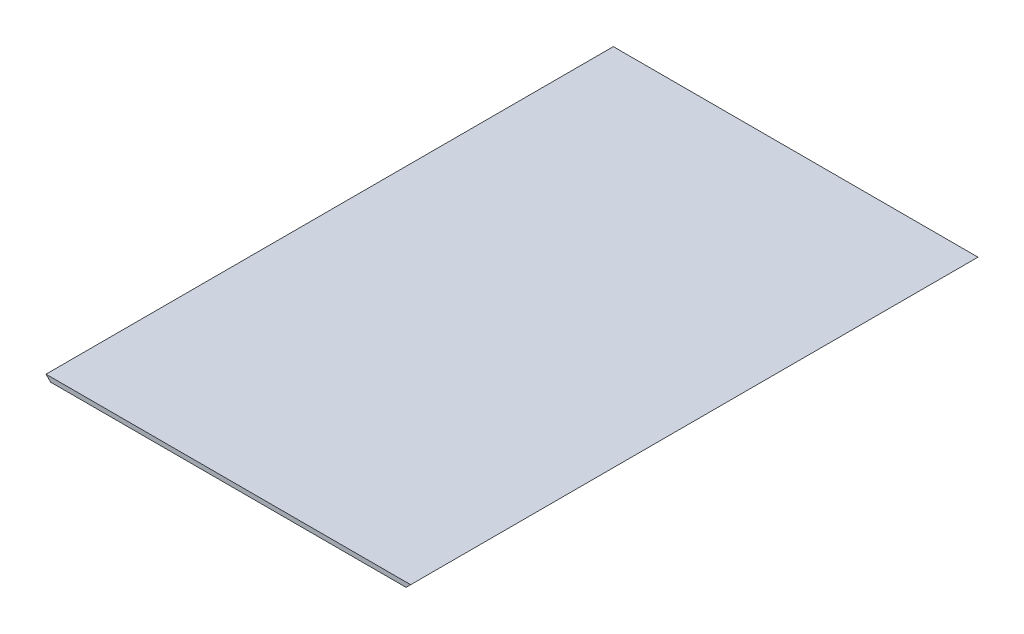
from build123d import *

# Parameters (mm, degrees)
SKETCH1_W           = 1262
SKETCH1_H           = 1969.52
BOSS_EXTRUDE1_DEPTH = 16
CUT_EXTRUDE1_DEPTH  = 2069.193905416
CUT_EXTRUDE3_DEPTH  = 1601.828615936


with BuildPart() as part:
    # Sketch1 → Boss-Extrude1 (new body)
    with BuildSketch(Plane(origin=(0, 0, 0), x_dir=(1, 0, 0), z_dir=(0, 1, 0))):
        Rectangle(SKETCH1_W, SKETCH1_H)
    extrude(amount=BOSS_EXTRUDE1_DEPTH)

    # Sketch2 → Cut-Extrude1 (cut, through all)
    with BuildSketch(Plane(origin=(0, 0, -984.76), x_dir=(-1, 0, 0), z_dir=(0, 0, -1))):
        Polygon((-631, 16), (-615, 0), (-631, 0), align=None)
        Polygon((631, 16), (615, 0), (631, 0), align=None)
    extrude(amount=-CUT_EXTRUDE1_DEPTH, mode=Mode.SUBTRACT)

    # Sketch4 → Cut-Extrude3 (cut, through all)
    with BuildSketch(Plane.ZY.offset(631)):
        Polygon((-984.76, 0), (-978.618175439, 16), (-984.76, 16), align=None)
    extrude(amount=-CUT_EXTRUDE3_DEPTH, mode=Mode.SUBTRACT)


solid = part.part
